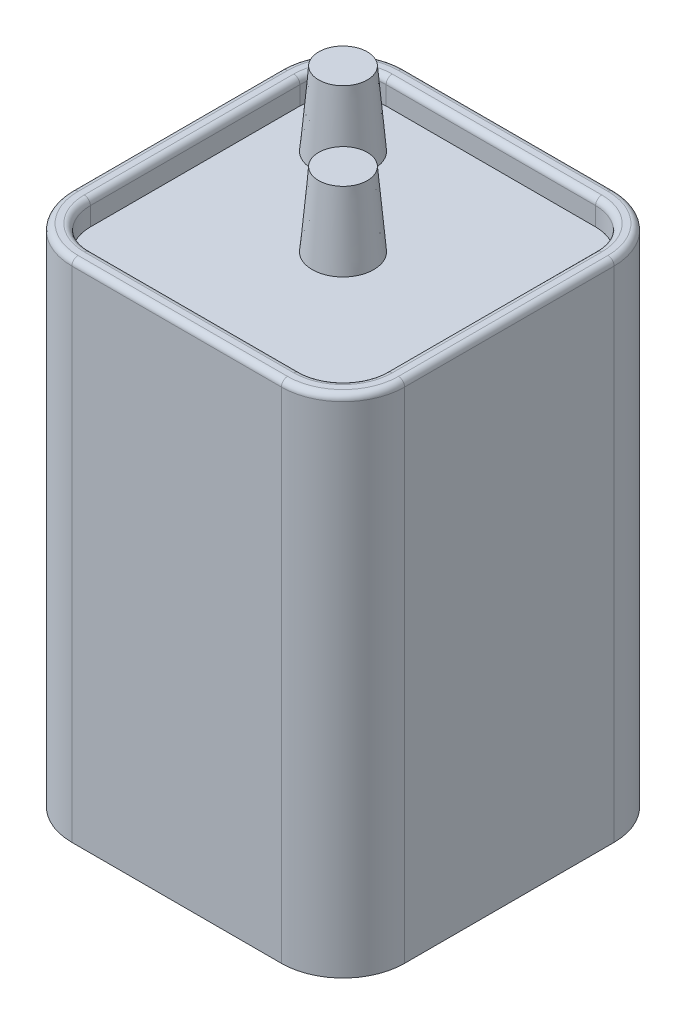
from build123d import *

# Parameters (mm, degrees)
SKETCH1_W                 = 68.58
SKETCH1_H                 = 68.58
BASE_EXTRUDE_DEPTH        = 104.14
SIDE_FILLETS_R            = 12.7
TOP_CUT_DEPTH             = 5.08
TOP_FACE_FILLET_R         = 1.27
SKETCH_TERMINALS_R        = 6.35
TERMINALS_DEPTH           = 15.24
TERMINALS_DRAFT           = 5
TERMINALS_PROFILE_2_DEPTH = 15.24
TERMINALS_PROFILE_2_DRAFT = 5


with BuildPart() as part:
    # Sketch1 → Base Extrude (new body)
    with BuildSketch(Plane(origin=(0, 0, 0), x_dir=(1, 0, 0), z_dir=(0, 1, 0))):
        Rectangle(SKETCH1_W, SKETCH1_H)
    extrude(amount=BASE_EXTRUDE_DEPTH)

    # Side Fillets
    side_fillets_edges = [part.edges().sort_by_distance(p)[0] for p in [
        (34.29, 52.07, 34.29),
        (-34.29, 52.07, 34.29),
        (-34.29, 52.07, -34.29),
        (34.29, 52.07, -34.29),
    ]]
    fillet(side_fillets_edges, radius=SIDE_FILLETS_R)

    # Sketch3 → Top Cut (cut)
    with BuildSketch(Plane(origin=(0, 104.14, 0), x_dir=(1, 0, 0), z_dir=(0, 1, 0))):
        with BuildLine():
            Line((21.59, 30.48), (-21.59, 30.48))
            ThreePointArc((-21.59, 30.48), (-27.876179285, 27.876179285), (-30.48, 21.59))
            Line((-30.48, 21.59), (-30.48, -21.59))
            ThreePointArc((-30.48, -21.59), (-27.876179285, -27.876179285), (-21.59, -30.48))
            Line((-21.59, -30.48), (21.59, -30.48))
            ThreePointArc((21.59, -30.48), (27.876179285, -27.876179285), (30.48, -21.59))
            Line((30.48, -21.59), (30.48, 21.59))
            ThreePointArc((30.48, 21.59), (27.876179285, 27.876179285), (21.59, 30.48))
        make_face()
    extrude(amount=-TOP_CUT_DEPTH, mode=Mode.SUBTRACT)

    # Top Face Fillet
    top_face_fillet_edges = [part.edges().sort_by_distance(p)[0] for p in [
        (-34.29, 104.14, 0),
        (0, 104.14, -34.29),
        (34.29, 104.14, 0),
        (0, 104.14, 34.29),
        (30.570256121, 104.14, 30.570256121),
        (30.570256121, 104.14, -30.570256121),
        (-30.570256121, 104.14, 30.570256121),
        (-30.570256121, 104.14, -30.570256121),
        (27.876179285, 104.14, -27.876179285),
        (0, 104.14, -30.48),
        (-27.876179285, 104.14, -27.876179285),
        (-30.48, 104.14, 0),
        (-27.876179285, 104.14, 27.876179285),
        (0, 104.14, 30.48),
        (27.876179285, 104.14, 27.876179285),
        (30.48, 104.14, 0),
    ]]
    fillet(top_face_fillet_edges, radius=TOP_FACE_FILLET_R)


with BuildPart() as terminals_tool:
    # Sketch-Terminals → Terminals (with draft: the straight prism first)
    with BuildSketch(Plane(origin=(0, 99.06, 0), x_dir=(1, 0, 0), z_dir=(0, 1, 0))):
        Circle(SKETCH_TERMINALS_R)
    extrude(amount=TERMINALS_DEPTH)
    # Terminals: the draft: its side faces are tilted about the plane it starts from
    terminals_sides = [terminals_tool.faces().sort_by_distance(p)[0] for p in [
        (-6.35, 106.68, 0),
    ]]
    draft(terminals_sides, Plane(origin=(0, 99.06, 0), x_dir=(1, 0, 0), z_dir=(0, 1, 0)), TERMINALS_DRAFT)


with BuildPart() as part_1:
    add(part.part)

    # Terminals: add terminals_tool
    add(terminals_tool.part)


with BuildPart() as terminals_profile_2_tool:
    # Sketch-Terminals → Terminals profile 2 (with draft: the straight prism first)
    with BuildSketch(Plane(origin=(0, 99.06, 0), x_dir=(1, 0, 0), z_dir=(0, 1, 0))):
        with Locations((-17.960512242, 17.960512242)):
            Circle(SKETCH_TERMINALS_R)
    extrude(amount=TERMINALS_PROFILE_2_DEPTH)
    # Terminals profile 2: the draft: its side faces are tilted about the plane it starts from
    terminals_profile_2_sides = [terminals_profile_2_tool.faces().sort_by_distance(p)[0] for p in [
        (-24.310512242, 106.68, -17.960512242),
    ]]
    draft(terminals_profile_2_sides, Plane(origin=(0, 99.06, 0), x_dir=(1, 0, 0), z_dir=(0, 1, 0)), TERMINALS_PROFILE_2_DRAFT)


with BuildPart() as part_2:
    add(part_1.part)

    # Terminals profile 2: add terminals_profile_2_tool
    add(terminals_profile_2_tool.part)


solid = part_2.part
